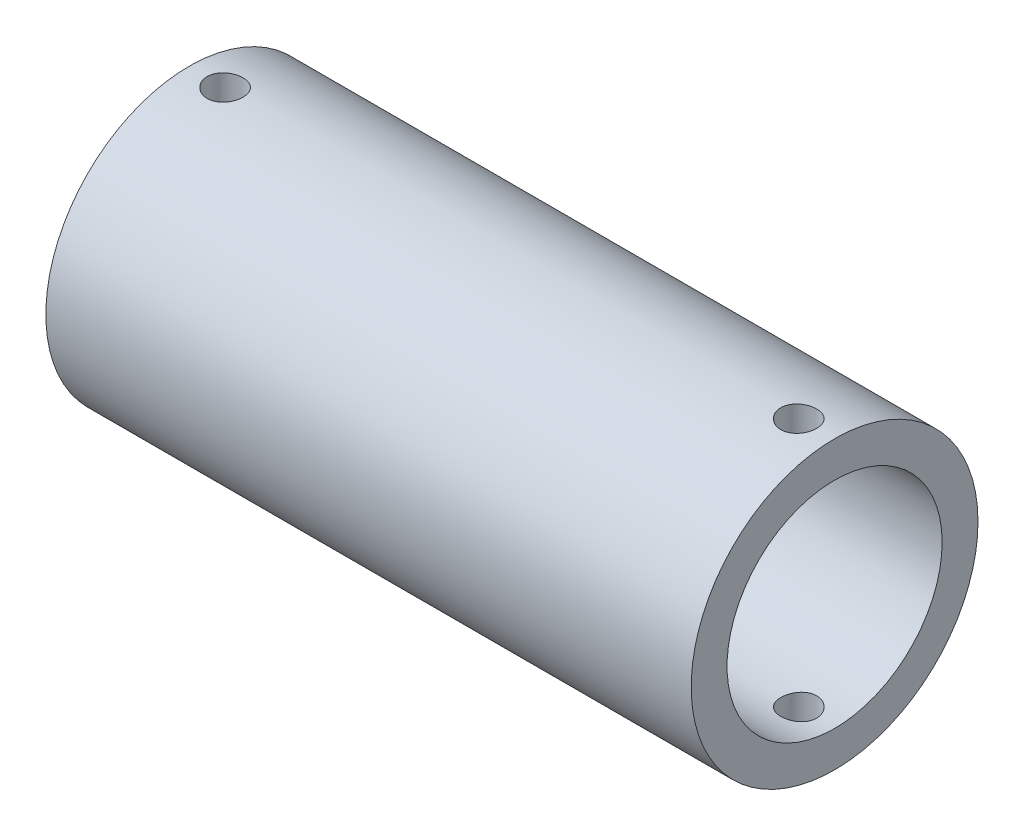
from build123d import *

# Parameters (mm, degrees)
CROQUIS1_R                 = 40
CROQUIS1_R_2               = 30
SALIENTE_EXTRUIR1_DEPTH    = 90
CORTAR_EXTRUIR1_DEPTH      = 107.301458127
CORTAR_EXTRUIR1_DEPTH_BACK = 107.301458127
CROQUIS2_R                 = 5


with BuildPart() as part:
    # Croquis1 → Saliente-Extruir1 (new, symmetric)
    with BuildSketch(Plane(origin=(0, 0, 0), x_dir=(0, 0, -1), z_dir=(1, 0, 0))):
        with Locations(Location((0, 0, 0), (0, 0, 180))):
            Circle(CROQUIS1_R)
        with Locations(Location((0, 0, 0), (0, 0, 180))):
            Circle(CROQUIS1_R_2, mode=Mode.SUBTRACT)
    extrude(amount=SALIENTE_EXTRUIR1_DEPTH, both=True)

    # Croquis2 → Cortar-Extruir1 (cut, two sides: drawn at the far end of the back side and taken through both)
    with BuildSketch(Plane(origin=(0, 0, 0), x_dir=(1, 0, 0), z_dir=(0, 1, 0)).offset(-CORTAR_EXTRUIR1_DEPTH_BACK)):
        with Locations(Location((-80, 0, 0), (0, 0, 270))):
            Circle(CROQUIS2_R)
        with Locations(Location((80, 0, 0), (0, 0, 270))):
            Circle(CROQUIS2_R)
    extrude(amount=CORTAR_EXTRUIR1_DEPTH + CORTAR_EXTRUIR1_DEPTH_BACK, mode=Mode.SUBTRACT)


solid = part.part
